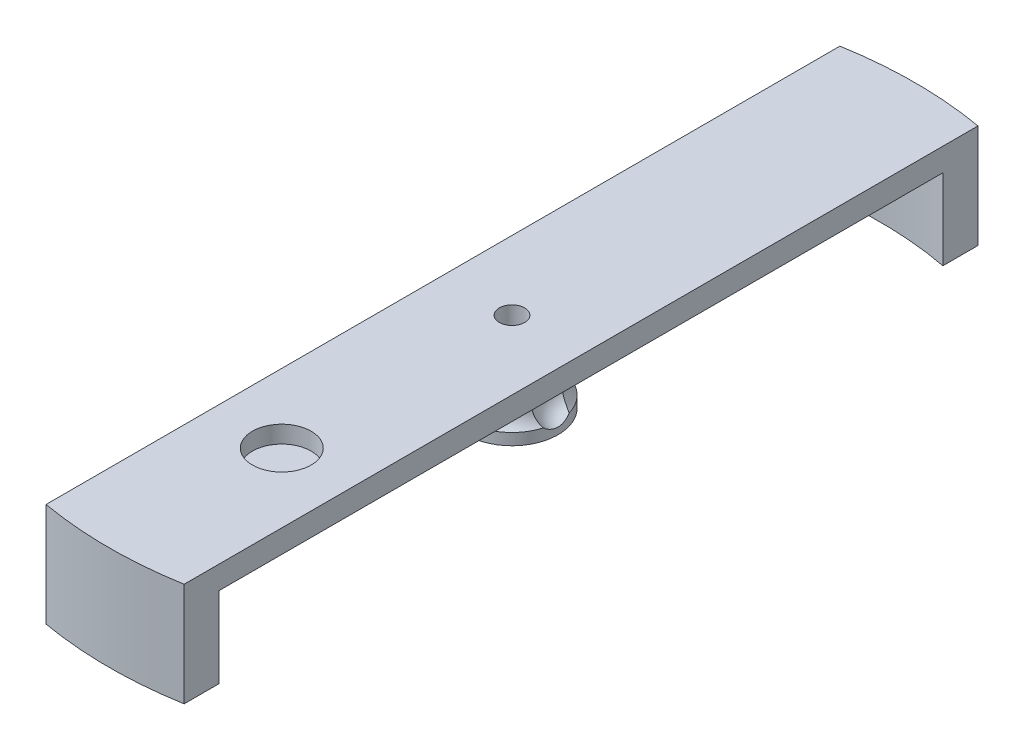
from build123d import *

# Parameters (mm, degrees)
CORTE_EXTRUS_O1_DEPTH      = 51.309044912
CORTE_EXTRUS_O1_DEPTH_BACK = 51.309044912
ESBO_O2_W                  = 96.741183006
ESBO_O2_H                  = 102.357875962
ESBO_O2_W_2                = 12
ESBO_O2_H_2                = 76.270119436
PADR_OCIRCULAR1_COUNT      = 4
ESBO_O4_R                  = 2.55
CORTE_EXTRUS_O2_DEPTH      = 1.5


with BuildPart() as part:
    # Esboço1 → Revolução1 (revolve)
    with BuildSketch(Plane.XY, mode=Mode.PRIVATE) as revolu_o1_sk:
        with BuildLine():
            Line((1.1, 7), (1.1, 0))
            Line((1.1, 0), (4, 0))
            Line((4, 0), (4, 1))
            ThreePointArc((4, 1), (3.3, 2.519868415), (4, 4.039736831))
            Line((4, 4.039736831), (4, 5))
            Line((4, 5), (32, 5))
            Line((32, 5), (32, -2))
            Line((32, -2), (35, -2))
            Line((35, -2), (35, 7))
            Line((35, 7), (3.5, 7))
            Line((3.5, 7), (1.1, 7))
        make_face()
    revolve(revolu_o1_sk.sketch.rotate(Axis((0, 0, 0), (0, 1, 0)), 90), axis=Axis((0, 0, 0), (0, 1, 0)))

    # Esboço2 → Corte-extrusão1 (cut, two sides: drawn at the far end of the back side and taken through both)
    with BuildSketch(Plane(origin=(0, 7, 0), x_dir=(1, 0, 0), z_dir=(0, 1, 0)).offset(-CORTE_EXTRUS_O1_DEPTH_BACK)):
        Rectangle(ESBO_O2_W, ESBO_O2_H)
        Rectangle(ESBO_O2_W_2, ESBO_O2_H_2, mode=Mode.SUBTRACT)
    extrude(amount=CORTE_EXTRUS_O1_DEPTH + CORTE_EXTRUS_O1_DEPTH_BACK, mode=Mode.SUBTRACT)

    # Esboço3 → Corte-Revolução1 (revolve, cut)
    with BuildSketch(Plane.XY):
        with BuildLine():
            Line((4.5, 4.519868415), (4.5, 0.519868415))
            ThreePointArc((4.5, 0.519868415), (2.5, 2.519868415), (4.5, 4.519868415))
        make_face()
    corte_revolu_o1 = revolve(axis=Axis((4.5, 4.519868415, 0), (0, -1, 0)), mode=Mode.SUBTRACT)

    # PadrãoCircular1: Corte-Revolução1 ×4 about axis
    padr_ocircular1_axis = Axis((0, 0, 0), (0, 1, 0))
    for i in range(1, PADR_OCIRCULAR1_COUNT):
        add(corte_revolu_o1.rotate(padr_ocircular1_axis, i * 360 / PADR_OCIRCULAR1_COUNT), mode=Mode.SUBTRACT)

    # Esboço4 → Corte-extrusão2 (cut)
    with BuildSketch(Plane(origin=(0, 7, 0), x_dir=(1, 0, 0), z_dir=(0, 1, 0))):
        with Locations(Location((0, -20, 0), (0, 0, 270))):
            Circle(ESBO_O4_R)
    extrude(amount=-CORTE_EXTRUS_O2_DEPTH, mode=Mode.SUBTRACT)


solid = part.part
